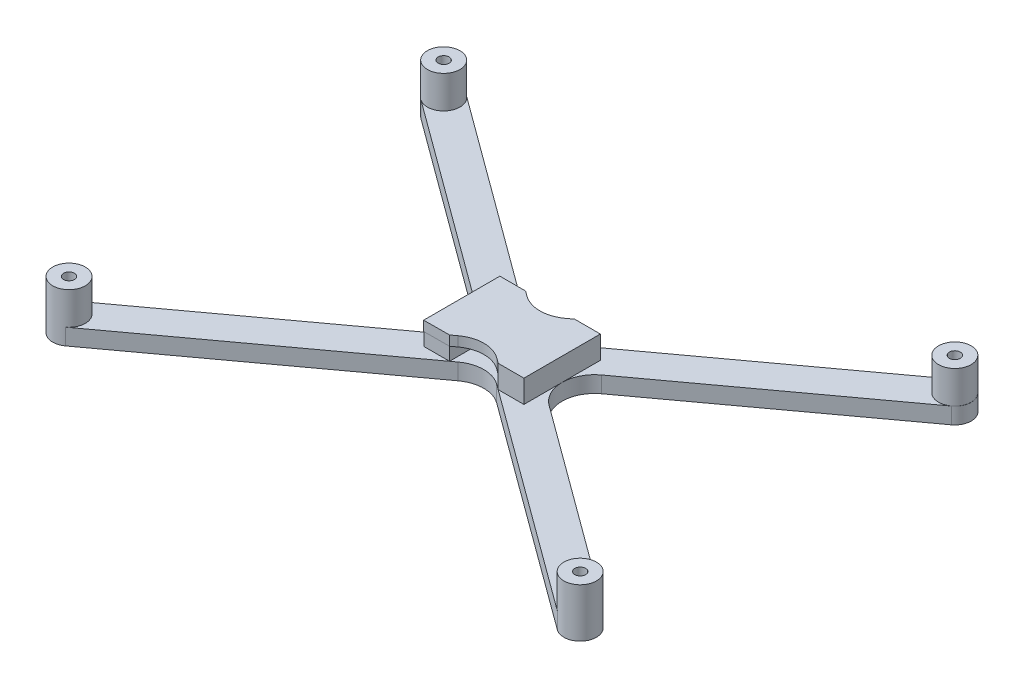
from build123d import *

# Parameters (mm, degrees)
SKETCH2_R           = 1.675
BOSS_EXTRUDE2_DEPTH = 5
SKETCH4_R           = 5
SKETCH4_R_2         = 1.675
BOSS_EXTRUDE3_DEPTH = 10
SKETCH7_W           = 7.89896268
SKETCH7_H           = 23.466499487
BOSS_EXTRUDE4_DEPTH = 4
BOSS_EXTRUDE5_DEPTH = 3


with BuildPart() as part:
    # Sketch2 → Boss-Extrude2 (new body)
    with BuildSketch(Plane(origin=(0, 0, 0), x_dir=(1, 0, 0), z_dir=(0, 1, 0))):
        with BuildLine():
            Line((-5.927337077, 10.543675079), (-75.494184373, 61.532760094))
            ThreePointArc((-75.494184373, 61.532760094), (-82.4827602, 60.455815483), (-81.405815339, 53.467239694))
            Line((-81.405815339, 53.467239694), (-19.473220794, 8.073687288))
            ThreePointArc((-19.473220794, 8.073687288), (-15.384851579, 0.009024421), (-19.471837334, -8.056339641))
            Line((-19.471837334, -8.056339641), (-81.406507067, -53.467746788))
            ThreePointArc((-81.406507067, -53.467746788), (-82.482253212, -60.456507067), (-75.493492933, -61.532253212))
            Line((-75.493492933, -61.532253212), (-5.946235564, -10.53918529))
            ThreePointArc((-5.946235564, -10.53918529), (-0.035497695, -8.603691918), (5.87612073, -10.53649412))
            Line((5.87612073, -10.53649412), (75.495328977, -61.533598783))
            ThreePointArc((75.495328977, -61.533598783), (82.483179585, -60.455243211), (81.405815339, -53.467239694))
            Line((81.405815339, -53.467239694), (19.501443033, -8.094372803))
            ThreePointArc((19.501443033, -8.094372803), (15.413073818, -0.029709936), (19.500059572, 8.035654125))
            Line((19.500059572, 8.035654125), (81.426238752, 53.440835874))
            ThreePointArc((81.426238752, 53.440835874), (82.509164133, 60.476238742), (75.473761267, 61.55916414))
            Line((75.473761267, 61.55916414), (5.897307879, 10.54468927))
            ThreePointArc((5.897307879, 10.54468927), (-0.014848637, 8.609195675), (-5.927337077, 10.543675079))
        make_face()
        with Locations(Location((-78.45, 57.5, 0), (0, 0, 270))):
            Circle(SKETCH2_R, mode=Mode.SUBTRACT)
        with Locations(Location((-78.45, -57.5, 0), (0, 0, 270))):
            Circle(SKETCH2_R, mode=Mode.SUBTRACT)
        with Locations(Location((78.45, 57.5, 0), (0, 0, 270))):
            Circle(SKETCH2_R, mode=Mode.SUBTRACT)
        with Locations(Location((78.45, -57.5, 0), (0, 0, 270))):
            Circle(SKETCH2_R, mode=Mode.SUBTRACT)
    extrude(amount=BOSS_EXTRUDE2_DEPTH)

    # Sketch4 → Boss-Extrude3 (add)
    # profile 1 of 4: a face of its own
    with BuildSketch(Plane(origin=(0, 5, 0), x_dir=(1, 0, 0), z_dir=(0, 1, 0))):
        with Locations(Location((-78.45, 57.5, 0), (0, 0, 53.760412974))):
            Circle(SKETCH4_R)
        with Locations(Location((-78.45, 57.5, 0), (0, 0, 270))):
            Circle(SKETCH4_R_2, mode=Mode.SUBTRACT)
    # profile 2 of 4: a face of its own
    with BuildSketch(Plane(origin=(0, 5, 0), x_dir=(1, 0, 0), z_dir=(0, 1, 0))):
        with Locations(Location((78.45, 57.5, 0), (0, 0, 270))):
            Circle(SKETCH4_R)
        with Locations(Location((78.45, 57.5, 0), (0, 0, 270))):
            Circle(SKETCH4_R_2, mode=Mode.SUBTRACT)
    # profile 3 of 4: a face of its own
    with BuildSketch(Plane(origin=(0, 5, 0), x_dir=(1, 0, 0), z_dir=(0, 1, 0))):
        with Locations(Location((-78.45, -57.5, 0), (0, 0, 126.24941546))):
            Circle(SKETCH4_R)
        with Locations(Location((-78.45, -57.5, 0), (0, 0, 270))):
            Circle(SKETCH4_R_2, mode=Mode.SUBTRACT)
    # profile 4 of 4: a face of its own
    with BuildSketch(Plane(origin=(0, 5, 0), x_dir=(1, 0, 0), z_dir=(0, 1, 0))):
        with Locations(Location((78.45, -57.5, 0), (0, 0, 53.760412974))):
            Circle(SKETCH4_R)
        with Locations(Location((78.45, -57.5, 0), (0, 0, 270))):
            Circle(SKETCH4_R_2, mode=Mode.SUBTRACT)
    extrude(amount=BOSS_EXTRUDE3_DEPTH)

    # Sketch7 → Boss-Extrude4 (add)
    with BuildSketch(Plane(origin=(0, 5, 0), x_dir=(1, 0, 0), z_dir=(0, 1, 0))):
        Polygon((-15.384851579, 0.009024421), (-15.384851579, -11.66808167), (-7.485888899, -11.66808167), (-7.485888899, -0.137260517), (-7.485888899, 11.686017077), (-15.384851579, 11.686017077), align=None)
        with Locations((11.463592441, -0.003096667)):
            Rectangle(SKETCH7_W, SKETCH7_H)
    extrude(amount=BOSS_EXTRUDE4_DEPTH)

    # Sketch8 → Boss-Extrude5 (add)
    with BuildSketch(Plane(origin=(0, 9, 0), x_dir=(1, 0, 0), z_dir=(0, 1, 0))):
        with BuildLine():
            Line((-15.384851579, -11.722899791), (-7.485888899, -11.66808167))
            Line((-7.485888899, -11.66808167), (-5.943452184, -10.53498393))
            ThreePointArc((-5.943452184, -10.53498393), (0.004475009, -8.594141897), (5.941608561, -10.567755551))
            Line((5.941608561, -10.567755551), (7.514111101, -11.73634641))
            Line((7.514111101, -11.73634641), (15.413073781, -11.73634641))
            Line((15.413073781, -11.73634641), (15.413073781, 11.730153077))
            Line((15.413073781, 11.730153077), (7.514111101, 11.730153077))
            Line((7.514111101, 11.730153077), (5.94895034, 10.569274798))
            ThreePointArc((5.94895034, 10.569274798), (0.014632257, 8.601189918), (-5.928647633, 10.542043685))
            Line((-5.928647633, 10.542043685), (-7.485888899, 11.686017077))
            Line((-7.485888899, 11.686017077), (-15.384851579, 11.686017077))
            Line((-15.384851579, 11.686017077), (-15.384851579, -11.722899791))
        make_face()
    extrude(amount=BOSS_EXTRUDE5_DEPTH)


solid = part.part
